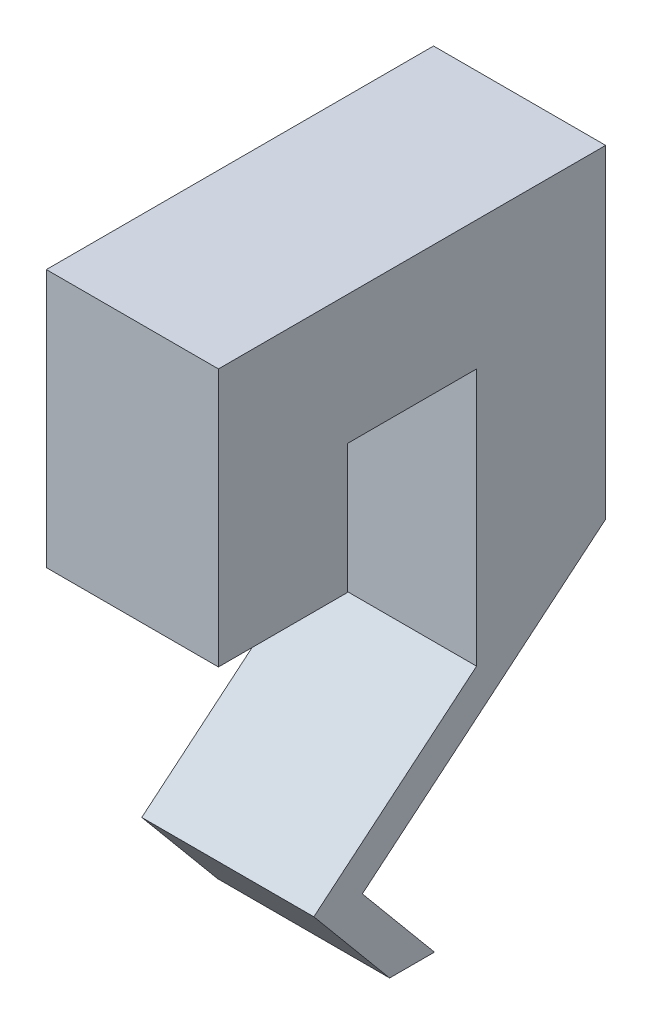
from build123d import *

# Parameters (mm, degrees)
BOSS_EXTRUDE1_DEPTH = 4


with BuildPart() as part:
    # Sketch1 → Boss-Extrude1 (new body)
    with BuildSketch(Plane(origin=(0, 0, 0), x_dir=(0, 0, -1), z_dir=(1, 0, 0))):
        Polygon((0, 0), (3, 0), (3, -5.983632242), (-0.782381606, -9.137006459), (0.979222601, -11.25), (2.020777399, -11.25), (0.344365115, -9.23919172), (6, -4.52408492), (6, 3), (-3, 3), (-3, -3), (0, -3), align=None)
    extrude(amount=BOSS_EXTRUDE1_DEPTH)


solid = part.part
